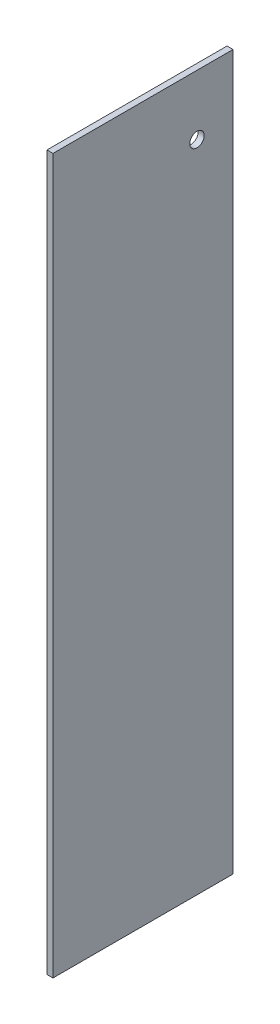
from build123d import *

# Parameters (mm, degrees)
BOSS_EXTRUDE1_DEPTH = 95.25
SKETCH2_R           = 3.175
CUT_EXTRUDE1_DEPTH  = 152.4
SKETCH4_R           = 34.925
SKETCH4_R_2         = 3.81
CUT_EXTRUDE2_DEPTH  = 381
SKETCH5_R           = 3.81
CUT_EXTRUDE3_DEPTH  = 12.7
SKETCH6_W           = 473.075
SKETCH6_H           = 95.25
CUT_EXTRUDE4_DEPTH  = 3.175


with BuildPart() as part:
    # Sketch1 → Boss-Extrude1 (new body)
    with BuildSketch(Plane.XY):
        Polygon((0, 0), (0, 381), (3.175, 381), (3.175, 3.175), (473.075, 3.175), (473.075, 0), align=None)
    extrude(amount=BOSS_EXTRUDE1_DEPTH)

    # Sketch2 → Cut-Extrude1 (cut)
    with BuildSketch(Plane(origin=(0, 3.175, 0), x_dir=(1, 0, 0), z_dir=(0, 1, 0))):
        with Locations(Location((190.119, -4.572, 0), (0, 0, 180))):
            Circle(SKETCH2_R)
        with Locations(Location((190.119, -76.2, 0), (0, 0, 180))):
            Circle(SKETCH2_R)
        with Locations(Location((261.747, -4.572, 0), (0, 0, 180))):
            Circle(SKETCH2_R)
        with Locations(Location((261.747, -76.2, 0), (0, 0, 180))):
            Circle(SKETCH2_R)
        with Locations(Location((295.783, -76.2, 0), (0, 0, 180))):
            Circle(SKETCH2_R)
        with Locations(Location((295.783, -4.572, 0), (0, 0, 180))):
            Circle(SKETCH2_R)
        with Locations(Location((367.411, -76.2, 0), (0, 0, 180))):
            Circle(SKETCH2_R)
        with Locations(Location((367.411, -4.572, 0), (0, 0, 180))):
            Circle(SKETCH2_R)
    extrude(amount=-CUT_EXTRUDE1_DEPTH, mode=Mode.SUBTRACT)

    # Sketch4 → Cut-Extrude2 (cut)
    with BuildSketch(Plane.XZ):
        with Locations((225.933, 40.386)):
            Circle(SKETCH4_R)
        with Locations((331.597, 40.386)):
            Circle(SKETCH4_R)
        with Locations((390.525, 19.05)):
            Circle(SKETCH4_R_2)
    extrude(amount=-CUT_EXTRUDE2_DEPTH, mode=Mode.SUBTRACT)

    # Sketch5 → Cut-Extrude3 (cut)
    with BuildSketch(Plane.ZY):
        with Locations((19.05, 349.25)):
            Circle(SKETCH5_R)
    extrude(amount=-CUT_EXTRUDE3_DEPTH, mode=Mode.SUBTRACT)

    # Sketch6 → Cut-Extrude4 (cut)
    with BuildSketch(Plane.XZ):
        with Locations((236.5375, 47.625)):
            Rectangle(SKETCH6_W, SKETCH6_H)
    extrude(amount=-CUT_EXTRUDE4_DEPTH, mode=Mode.SUBTRACT)


solid = part.part
